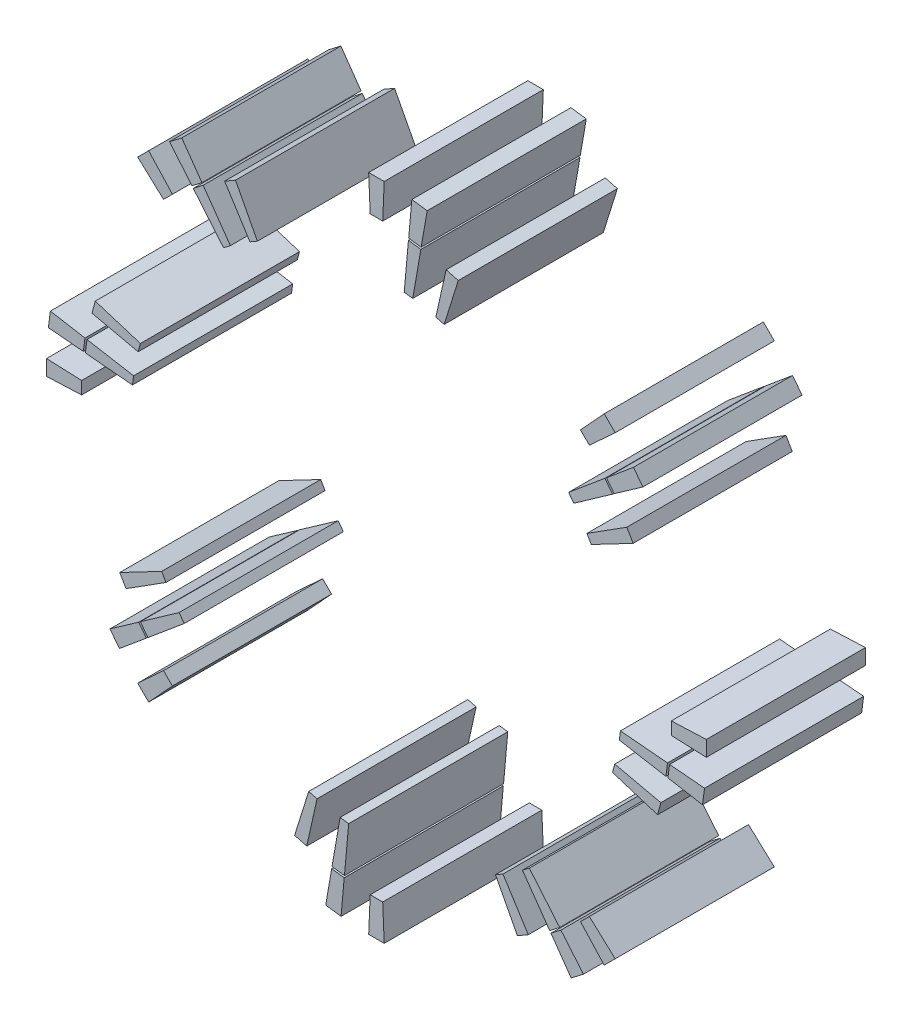
from build123d import *

# Parameters (mm, degrees)
SLOT_COPPER_ENVELOPES_START    = -15
SLOT_COPPER_ENVELOPES_DEPTH    = 30
SLOT_COPPER_ENVELOPES_2_DEPTH  = 30
SLOT_COPPER_ENVELOPES_3_DEPTH  = 30
SLOT_COPPER_ENVELOPES_4_DEPTH  = 30
SLOT_COPPER_ENVELOPES_5_DEPTH  = 30
SLOT_COPPER_ENVELOPES_6_DEPTH  = 30
SLOT_COPPER_ENVELOPES_7_DEPTH  = 30
SLOT_COPPER_ENVELOPES_8_DEPTH  = 30
SLOT_COPPER_ENVELOPES_9_DEPTH  = 30
SLOT_COPPER_ENVELOPES_10_DEPTH = 30
SLOT_COPPER_ENVELOPES_11_DEPTH = 30
SLOT_COPPER_ENVELOPES_12_DEPTH = 30
SLOT_COPPER_ENVELOPES_13_DEPTH = 30
SLOT_COPPER_ENVELOPES_14_DEPTH = 30
SLOT_COPPER_ENVELOPES_15_DEPTH = 30
SLOT_COPPER_ENVELOPES_16_DEPTH = 30
SLOT_COPPER_ENVELOPES_17_DEPTH = 30
SLOT_COPPER_ENVELOPES_18_DEPTH = 30
SLOT_COPPER_ENVELOPES_19_DEPTH = 30
SLOT_COPPER_ENVELOPES_20_DEPTH = 30
SLOT_COPPER_ENVELOPES_21_DEPTH = 30
SLOT_COPPER_ENVELOPES_22_DEPTH = 30
SLOT_COPPER_ENVELOPES_23_DEPTH = 30
SLOT_COPPER_ENVELOPES_24_DEPTH = 30
SLOT_COPPER_ENVELOPES_25_DEPTH = 30
SLOT_COPPER_ENVELOPES_26_DEPTH = 30
SLOT_COPPER_ENVELOPES_27_DEPTH = 30
SLOT_COPPER_ENVELOPES_28_DEPTH = 30
SLOT_COPPER_ENVELOPES_29_DEPTH = 30
SLOT_COPPER_ENVELOPES_30_DEPTH = 30
SLOT_COPPER_ENVELOPES_31_DEPTH = 30
SLOT_COPPER_ENVELOPES_32_DEPTH = 30


with BuildPart() as part:
    # Эскиз1 → Slot_copper_envelopes (new body)
    with BuildSketch(Plane.XY.offset(SLOT_COPPER_ENVELOPES_START)):
        Polygon((55.587417434, -1.18280303), (62.2, -1.4625), (62.2, 1.4625), (55.587417434, 1.18280303), align=None)
    extrude(amount=SLOT_COPPER_ENVELOPES_DEPTH)


with BuildPart() as body_2:
    # Эскиз1 → Slot_copper_envelopes 2 (new body)
    with BuildSketch(Plane.XY.offset(SLOT_COPPER_ENVELOPES_START)):
        Polygon((40.497051723, 22.442789526), (48.396003804, 26.575662528), (47.213200774, 28.624337472), (39.684551723, 23.850080808), align=None)
    extrude(amount=SLOT_COPPER_ENVELOPES_2_DEPTH)


with BuildPart() as body_3:
    # Эскиз1 → Slot_copper_envelopes 3 (new body)
    with BuildSketch(Plane.XY.offset(SLOT_COPPER_ENVELOPES_START)):
        Polygon((44.820508162, 32.901094937), (50.236891356, 36.704681624), (48.456264176, 39.025240145), (43.380418437, 34.777856407), align=None)
    extrude(amount=SLOT_COPPER_ENVELOPES_3_DEPTH)


with BuildPart() as body_4:
    # Эскиз1 → Slot_copper_envelopes 4 (new body)
    with BuildSketch(Plane.XY.offset(SLOT_COPPER_ENVELOPES_START)):
        Polygon((37.221221972, 27.536714308), (44.513149247, 32.665250146), (43.073059521, 34.542011616), (36.23198465, 28.825913486), align=None)
    extrude(amount=SLOT_COPPER_ENVELOPES_4_DEPTH)


with BuildPart() as body_5:
    # Эскиз1 → Slot_copper_envelopes 5 (new body)
    with BuildSketch(Plane.XY.offset(SLOT_COPPER_ENVELOPES_START)):
        Polygon((40.14260786, 38.469871773), (45.016185457, 42.947898122), (42.947898122, 45.016185457), (38.469871773, 40.14260786), align=None)
    extrude(amount=SLOT_COPPER_ENVELOPES_5_DEPTH)


with BuildPart() as body_6:
    # Эскиз1 → Slot_copper_envelopes 6 (new body)
    with BuildSketch(Plane.XY.offset(SLOT_COPPER_ENVELOPES_START)):
        Polygon((12.766291229, 44.505188554), (15.429311284, 53.01297366), (13.144311295, 53.625237562), (11.196661761, 44.925769503), align=None)
    extrude(amount=SLOT_COPPER_ENVELOPES_6_DEPTH)


with BuildPart() as body_7:
    # Эскиз1 → Slot_copper_envelopes 7 (new body)
    with BuildSketch(Plane.XY.offset(SLOT_COPPER_ENVELOPES_START)):
        Polygon((8.428297919, 54.957472596), (9.568717266, 61.476975821), (6.668741046, 61.858764934), (6.082929947, 55.266246148), align=None)
    extrude(amount=SLOT_COPPER_ENVELOPES_7_DEPTH)


with BuildPart() as body_8:
    # Эскиз1 → Slot_copper_envelopes 8 (new body)
    with BuildSketch(Plane.XY.offset(SLOT_COPPER_ENVELOPES_START)):
        Polygon((6.847981041, 45.79077588), (8.377729797, 54.573369572), (6.032361824, 54.882143124), (5.236883142, 46.002880942), align=None)
    extrude(amount=SLOT_COPPER_ENVELOPES_8_DEPTH)


with BuildPart() as body_9:
    # Эскиз1 → Slot_copper_envelopes 9 (new body)
    with BuildSketch(Plane.XY.offset(SLOT_COPPER_ENVELOPES_START)):
        Polygon((1.18280303, 55.587417434), (1.4625, 62.2), (-1.4625, 62.2), (-1.18280303, 55.587417434), align=None)
    extrude(amount=SLOT_COPPER_ENVELOPES_9_DEPTH)


with BuildPart() as body_10:
    # Эскиз1 → Slot_copper_envelopes 10 (new body)
    with BuildSketch(Plane.XY.offset(SLOT_COPPER_ENVELOPES_START)):
        Polygon((-22.442789526, 40.497051723), (-26.575662528, 48.396003804), (-28.624337472, 47.213200774), (-23.850080808, 39.684551723), align=None)
    extrude(amount=SLOT_COPPER_ENVELOPES_10_DEPTH)


with BuildPart() as body_11:
    # Эскиз1 → Slot_copper_envelopes 11 (new body)
    with BuildSketch(Plane.XY.offset(SLOT_COPPER_ENVELOPES_START)):
        Polygon((-32.901094937, 44.820508162), (-36.704681624, 50.236891356), (-39.025240145, 48.456264176), (-34.777856407, 43.380418437), align=None)
    extrude(amount=SLOT_COPPER_ENVELOPES_11_DEPTH)


with BuildPart() as body_12:
    # Эскиз1 → Slot_copper_envelopes 12 (new body)
    with BuildSketch(Plane.XY.offset(SLOT_COPPER_ENVELOPES_START)):
        Polygon((-27.536714308, 37.221221972), (-32.665250146, 44.513149247), (-34.542011616, 43.073059521), (-28.825913486, 36.23198465), align=None)
    extrude(amount=SLOT_COPPER_ENVELOPES_12_DEPTH)


with BuildPart() as body_13:
    # Эскиз1 → Slot_copper_envelopes 13 (new body)
    with BuildSketch(Plane.XY.offset(SLOT_COPPER_ENVELOPES_START)):
        Polygon((-38.469871773, 40.14260786), (-42.947898122, 45.016185457), (-45.016185457, 42.947898122), (-40.14260786, 38.469871773), align=None)
    extrude(amount=SLOT_COPPER_ENVELOPES_13_DEPTH)


with BuildPart() as body_14:
    # Эскиз1 → Slot_copper_envelopes 14 (new body)
    with BuildSketch(Plane.XY.offset(SLOT_COPPER_ENVELOPES_START)):
        Polygon((-44.505188554, 12.766291229), (-53.01297366, 15.429311284), (-53.625237562, 13.144311295), (-44.925769503, 11.196661761), align=None)
    extrude(amount=SLOT_COPPER_ENVELOPES_14_DEPTH)


with BuildPart() as body_15:
    # Эскиз1 → Slot_copper_envelopes 15 (new body)
    with BuildSketch(Plane.XY.offset(SLOT_COPPER_ENVELOPES_START)):
        Polygon((-54.957472596, 8.428297919), (-61.476975821, 9.568717266), (-61.858764934, 6.668741046), (-55.266246148, 6.082929947), align=None)
    extrude(amount=SLOT_COPPER_ENVELOPES_15_DEPTH)


with BuildPart() as body_16:
    # Эскиз1 → Slot_copper_envelopes 16 (new body)
    with BuildSketch(Plane.XY.offset(SLOT_COPPER_ENVELOPES_START)):
        Polygon((-45.79077588, 6.847981041), (-54.573369572, 8.377729797), (-54.882143124, 6.032361824), (-46.002880942, 5.236883142), align=None)
    extrude(amount=SLOT_COPPER_ENVELOPES_16_DEPTH)


with BuildPart() as body_17:
    # Эскиз1 → Slot_copper_envelopes 17 (new body)
    with BuildSketch(Plane.XY.offset(SLOT_COPPER_ENVELOPES_START)):
        Polygon((-55.587417434, 1.18280303), (-62.2, 1.4625), (-62.2, -1.4625), (-55.587417434, -1.18280303), align=None)
    extrude(amount=SLOT_COPPER_ENVELOPES_17_DEPTH)


with BuildPart() as body_18:
    # Эскиз1 → Slot_copper_envelopes 18 (new body)
    with BuildSketch(Plane.XY.offset(SLOT_COPPER_ENVELOPES_START)):
        Polygon((-40.497051723, -22.442789526), (-48.396003804, -26.575662528), (-47.213200774, -28.624337472), (-39.684551723, -23.850080808), align=None)
    extrude(amount=SLOT_COPPER_ENVELOPES_18_DEPTH)


with BuildPart() as body_19:
    # Эскиз1 → Slot_copper_envelopes 19 (new body)
    with BuildSketch(Plane.XY.offset(SLOT_COPPER_ENVELOPES_START)):
        Polygon((-44.820508162, -32.901094937), (-50.236891356, -36.704681624), (-48.456264176, -39.025240145), (-43.380418437, -34.777856407), align=None)
    extrude(amount=SLOT_COPPER_ENVELOPES_19_DEPTH)


with BuildPart() as body_20:
    # Эскиз1 → Slot_copper_envelopes 20 (new body)
    with BuildSketch(Plane.XY.offset(SLOT_COPPER_ENVELOPES_START)):
        Polygon((-37.221221972, -27.536714308), (-44.513149247, -32.665250146), (-43.073059521, -34.542011616), (-36.23198465, -28.825913486), align=None)
    extrude(amount=SLOT_COPPER_ENVELOPES_20_DEPTH)


with BuildPart() as body_21:
    # Эскиз1 → Slot_copper_envelopes 21 (new body)
    with BuildSketch(Plane.XY.offset(SLOT_COPPER_ENVELOPES_START)):
        Polygon((-40.14260786, -38.469871773), (-45.016185457, -42.947898122), (-42.947898122, -45.016185457), (-38.469871773, -40.14260786), align=None)
    extrude(amount=SLOT_COPPER_ENVELOPES_21_DEPTH)


with BuildPart() as body_22:
    # Эскиз1 → Slot_copper_envelopes 22 (new body)
    with BuildSketch(Plane.XY.offset(SLOT_COPPER_ENVELOPES_START)):
        Polygon((-12.766291229, -44.505188554), (-15.429311284, -53.01297366), (-13.144311295, -53.625237562), (-11.196661761, -44.925769503), align=None)
    extrude(amount=SLOT_COPPER_ENVELOPES_22_DEPTH)


with BuildPart() as body_23:
    # Эскиз1 → Slot_copper_envelopes 23 (new body)
    with BuildSketch(Plane.XY.offset(SLOT_COPPER_ENVELOPES_START)):
        Polygon((-8.428297919, -54.957472596), (-9.568717266, -61.476975821), (-6.668741046, -61.858764934), (-6.082929947, -55.266246148), align=None)
    extrude(amount=SLOT_COPPER_ENVELOPES_23_DEPTH)


with BuildPart() as body_24:
    # Эскиз1 → Slot_copper_envelopes 24 (new body)
    with BuildSketch(Plane.XY.offset(SLOT_COPPER_ENVELOPES_START)):
        Polygon((-6.847981041, -45.79077588), (-8.377729797, -54.573369572), (-6.032361824, -54.882143124), (-5.236883142, -46.002880942), align=None)
    extrude(amount=SLOT_COPPER_ENVELOPES_24_DEPTH)


with BuildPart() as body_25:
    # Эскиз1 → Slot_copper_envelopes 25 (new body)
    with BuildSketch(Plane.XY.offset(SLOT_COPPER_ENVELOPES_START)):
        Polygon((-1.18280303, -55.587417434), (-1.4625, -62.2), (1.4625, -62.2), (1.18280303, -55.587417434), align=None)
    extrude(amount=SLOT_COPPER_ENVELOPES_25_DEPTH)


with BuildPart() as body_26:
    # Эскиз1 → Slot_copper_envelopes 26 (new body)
    with BuildSketch(Plane.XY.offset(SLOT_COPPER_ENVELOPES_START)):
        Polygon((22.442789526, -40.497051723), (26.575662528, -48.396003804), (28.624337472, -47.213200774), (23.850080808, -39.684551723), align=None)
    extrude(amount=SLOT_COPPER_ENVELOPES_26_DEPTH)


with BuildPart() as body_27:
    # Эскиз1 → Slot_copper_envelopes 27 (new body)
    with BuildSketch(Plane.XY.offset(SLOT_COPPER_ENVELOPES_START)):
        Polygon((32.901094937, -44.820508162), (36.704681624, -50.236891356), (39.025240145, -48.456264176), (34.777856407, -43.380418437), align=None)
    extrude(amount=SLOT_COPPER_ENVELOPES_27_DEPTH)


with BuildPart() as body_28:
    # Эскиз1 → Slot_copper_envelopes 28 (new body)
    with BuildSketch(Plane.XY.offset(SLOT_COPPER_ENVELOPES_START)):
        Polygon((27.536714308, -37.221221972), (32.665250146, -44.513149247), (34.542011616, -43.073059521), (28.825913486, -36.23198465), align=None)
    extrude(amount=SLOT_COPPER_ENVELOPES_28_DEPTH)


with BuildPart() as body_29:
    # Эскиз1 → Slot_copper_envelopes 29 (new body)
    with BuildSketch(Plane.XY.offset(SLOT_COPPER_ENVELOPES_START)):
        Polygon((38.469871773, -40.14260786), (42.947898122, -45.016185457), (45.016185457, -42.947898122), (40.14260786, -38.469871773), align=None)
    extrude(amount=SLOT_COPPER_ENVELOPES_29_DEPTH)


with BuildPart() as body_30:
    # Эскиз1 → Slot_copper_envelopes 30 (new body)
    with BuildSketch(Plane.XY.offset(SLOT_COPPER_ENVELOPES_START)):
        Polygon((44.505188554, -12.766291229), (53.01297366, -15.429311284), (53.625237562, -13.144311295), (44.925769503, -11.196661761), align=None)
    extrude(amount=SLOT_COPPER_ENVELOPES_30_DEPTH)


with BuildPart() as body_31:
    # Эскиз1 → Slot_copper_envelopes 31 (new body)
    with BuildSketch(Plane.XY.offset(SLOT_COPPER_ENVELOPES_START)):
        Polygon((54.957472596, -8.428297919), (61.476975821, -9.568717266), (61.858764934, -6.668741046), (55.266246148, -6.082929947), align=None)
    extrude(amount=SLOT_COPPER_ENVELOPES_31_DEPTH)


with BuildPart() as body_32:
    # Эскиз1 → Slot_copper_envelopes 32 (new body)
    with BuildSketch(Plane.XY.offset(SLOT_COPPER_ENVELOPES_START)):
        Polygon((45.79077588, -6.847981041), (54.573369572, -8.377729797), (54.882143124, -6.032361824), (46.002880942, -5.236883142), align=None)
    extrude(amount=SLOT_COPPER_ENVELOPES_32_DEPTH)


solid = Compound([part.part, body_2.part, body_3.part, body_4.part, body_5.part, body_6.part, body_7.part, body_8.part, body_9.part, body_10.part, body_11.part, body_12.part, body_13.part, body_14.part, body_15.part, body_16.part, body_17.part, body_18.part, body_19.part, body_20.part, body_21.part, body_22.part, body_23.part, body_24.part, body_25.part, body_26.part, body_27.part, body_28.part, body_29.part, body_30.part, body_31.part, body_32.part])
